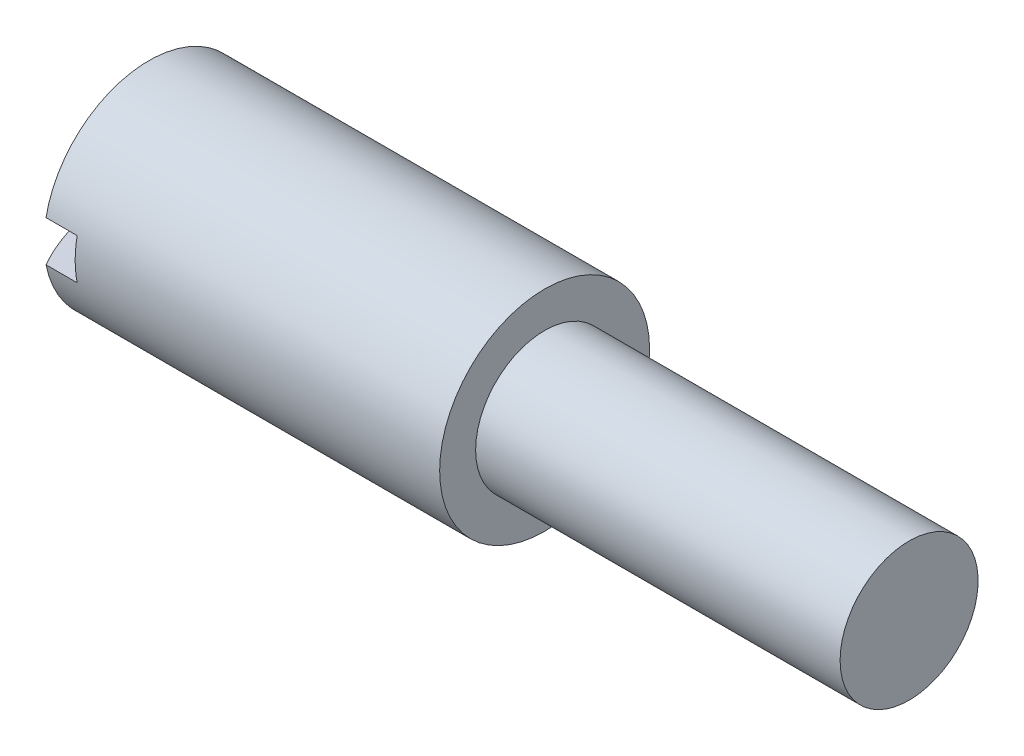
from build123d import *

# Parameters (mm, degrees)
SKETCH2_W               = 5.4864
SKETCH2_H               = 1.0668
SLOT_DEPTH              = 1.5494
CROQUIS1_R              = 3.23116627
CORTAR_EXTRUIR1_DEPTH   = 12.709724159
CROQUIS4_R              = 1.8034
SALIENTE_EXTRUIR1_DEPTH = 9.525


with BuildPart() as part:
    # BodySke → BaseBody (revolve)
    with BuildSketch(Plane.XY, mode=Mode.PRIVATE) as basebody_sk:
        with BuildLine():
            Line((14.351, 0), (14.351, 1.4605))
            Line((14.351, 1.4605), (13.0683, 2.7432))
            Line((13.0683, 2.7432), (0.735038225, 2.7432))
            ThreePointArc((0.735038225, 2.7432), (0.186944547, 1.419984809), (0, 0))
            Line((0, 0), (14.351, 0))
        make_face()
    revolve(basebody_sk.sketch.rotate(Axis((-12.7, 0, 0), (1, 0, 0)), 90), axis=Axis((-12.7, 0, 0), (1, 0, 0)))

    # Sketch2 → Slot (cut)
    with BuildSketch(Plane(origin=(0, 0, 0), x_dir=(0, 0, -1), z_dir=(1, 0, 0))):
        Rectangle(SKETCH2_W, SKETCH2_H)
    extrude(amount=SLOT_DEPTH, mode=Mode.SUBTRACT)

    # Croquis1 → Cortar-Extruir1 (cut, through all)
    with BuildSketch(Plane.ZY.offset(-11.0744)):
        Circle(CROQUIS1_R)
    extrude(amount=-CORTAR_EXTRUIR1_DEPTH, mode=Mode.SUBTRACT)

    # Croquis4 → Saliente-Extruir1 (add)
    with BuildSketch(Plane(origin=(11.0744, 0, 0), x_dir=(0, 0, -1), z_dir=(1, 0, 0))):
        with Locations(Location((0, 0, 0), (0, 0, 180))):
            Circle(CROQUIS4_R)
    extrude(amount=SALIENTE_EXTRUIR1_DEPTH)


solid = part.part
